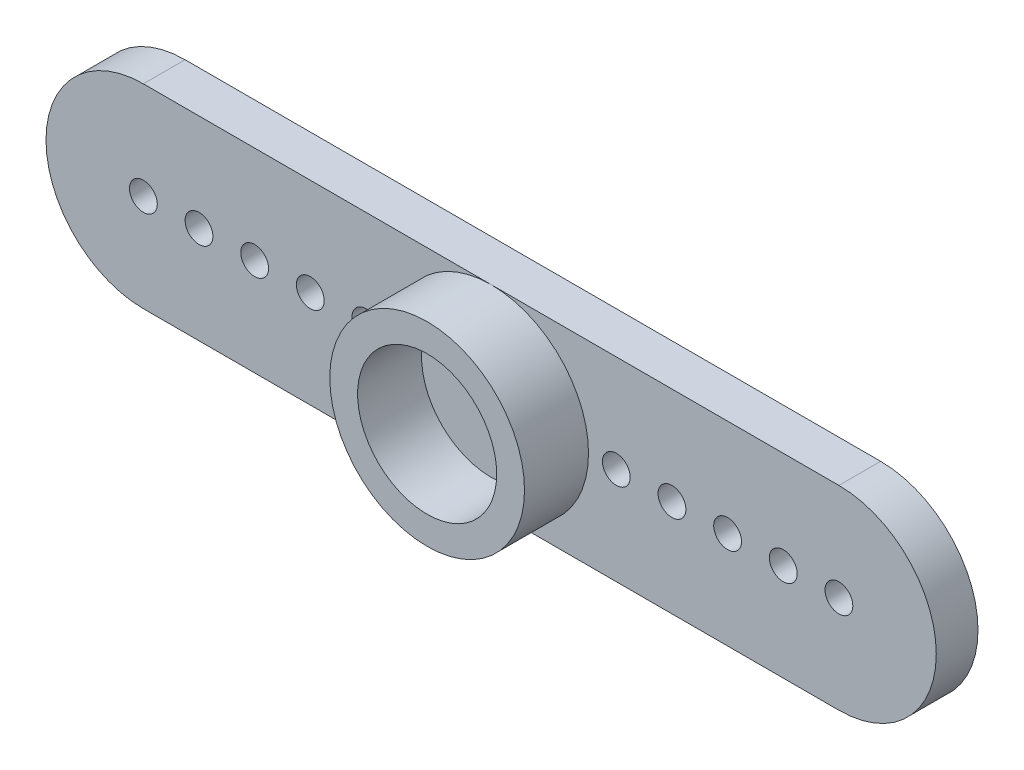
from build123d import *

# Parameters (mm, degrees)
SALIENTE_EXTRUIR1_DEPTH = 1.5
CROQUIS2_R              = 3.5
CROQUIS2_R_2            = 2.5
SALIENTE_EXTRUIR2_DEPTH = 2.3
CROQUIS4_R              = 0.5
CORTAR_EXTRUIR1_DEPTH   = 29.964460982
CORTAR_EXTRUIR2_REACH   = 30.964
CROQUIS5_R              = 0.5


with BuildPart() as part:
    # Croquis1 → Saliente-Extruir1 (new body)
    with BuildSketch(Plane.XY):
        with BuildLine():
            Line((0, 3.5), (25, 3.5))
            ThreePointArc((25, 3.5), (28.5, 0), (25, -3.5))
            Line((25, -3.5), (0, -3.5))
            ThreePointArc((0, -3.5), (-3.5, 0), (0, 3.5))
        make_face()
    extrude(amount=SALIENTE_EXTRUIR1_DEPTH)

    # Croquis2 → Saliente-Extruir2 (add)
    with BuildSketch(Plane.XY.offset(1.5)):
        with Locations(Location((12.5, 0, 0), (0, 0, 270))):
            Circle(CROQUIS2_R)
        with Locations((12.5, 0)):
            Circle(CROQUIS2_R_2, mode=Mode.SUBTRACT)
    extrude(amount=SALIENTE_EXTRUIR2_DEPTH)

    # Croquis4 → Cortar-Extruir1 (cut, through all)
    with BuildSketch(Plane(origin=(0, 0, 0), x_dir=(-1, 0, 0), z_dir=(0, 0, -1))):
        Circle(CROQUIS4_R)
        with Locations(Location((-25, 0, 0), (0, 0, 180))):
            Circle(CROQUIS4_R)
    extrude(amount=-CORTAR_EXTRUIR1_DEPTH, mode=Mode.SUBTRACT)

    # Croquis5 → Cortar-Extruir2 (cut, up to next)
    with BuildSketch(Plane(origin=(0, 0, 0), x_dir=(-1, 0, 0), z_dir=(0, 0, -1)), mode=Mode.PRIVATE) as cortar_extruir2_sk1:
        with Locations((-8, 0)):
            Circle(CROQUIS5_R)
    cortar_extruir2_tool1 = extrude(cortar_extruir2_sk1.sketch, amount=-CORTAR_EXTRUIR2_REACH, mode=Mode.PRIVATE) & part.part
    # Croquis5 → Cortar-Extruir2 (cut, up to next)
    with BuildSketch(Plane(origin=(0, 0, 0), x_dir=(-1, 0, 0), z_dir=(0, 0, -1)), mode=Mode.PRIVATE) as cortar_extruir2_sk2:
        with Locations((-6, 0)):
            Circle(CROQUIS5_R)
    cortar_extruir2_tool2 = extrude(cortar_extruir2_sk2.sketch, amount=-CORTAR_EXTRUIR2_REACH, mode=Mode.PRIVATE) & part.part
    # Croquis5 → Cortar-Extruir2 (cut, up to next)
    with BuildSketch(Plane(origin=(0, 0, 0), x_dir=(-1, 0, 0), z_dir=(0, 0, -1)), mode=Mode.PRIVATE) as cortar_extruir2_sk3:
        with Locations((-4, 0)):
            Circle(CROQUIS5_R)
    cortar_extruir2_tool3 = extrude(cortar_extruir2_sk3.sketch, amount=-CORTAR_EXTRUIR2_REACH, mode=Mode.PRIVATE) & part.part
    # Croquis5 → Cortar-Extruir2 (cut, up to next)
    with BuildSketch(Plane(origin=(0, 0, 0), x_dir=(-1, 0, 0), z_dir=(0, 0, -1)), mode=Mode.PRIVATE) as cortar_extruir2_sk4:
        with Locations((-2, 0)):
            Circle(CROQUIS5_R)
    cortar_extruir2_tool4 = extrude(cortar_extruir2_sk4.sketch, amount=-CORTAR_EXTRUIR2_REACH, mode=Mode.PRIVATE) & part.part
    # Croquis5 → Cortar-Extruir2 (cut, up to next)
    with BuildSketch(Plane(origin=(0, 0, 0), x_dir=(-1, 0, 0), z_dir=(0, 0, -1)), mode=Mode.PRIVATE) as cortar_extruir2_sk5:
        with Locations(Location((-23, 0, 0), (0, 0, 180))):
            Circle(CROQUIS5_R)
    cortar_extruir2_tool5 = extrude(cortar_extruir2_sk5.sketch, amount=-CORTAR_EXTRUIR2_REACH, mode=Mode.PRIVATE) & part.part
    # Croquis5 → Cortar-Extruir2 (cut, up to next)
    with BuildSketch(Plane(origin=(0, 0, 0), x_dir=(-1, 0, 0), z_dir=(0, 0, -1)), mode=Mode.PRIVATE) as cortar_extruir2_sk6:
        with Locations(Location((-21, 0, 0), (0, 0, 180))):
            Circle(CROQUIS5_R)
    cortar_extruir2_tool6 = extrude(cortar_extruir2_sk6.sketch, amount=-CORTAR_EXTRUIR2_REACH, mode=Mode.PRIVATE) & part.part
    # Croquis5 → Cortar-Extruir2 (cut, up to next)
    with BuildSketch(Plane(origin=(0, 0, 0), x_dir=(-1, 0, 0), z_dir=(0, 0, -1)), mode=Mode.PRIVATE) as cortar_extruir2_sk7:
        with Locations(Location((-19, 0, 0), (0, 0, 180))):
            Circle(CROQUIS5_R)
    cortar_extruir2_tool7 = extrude(cortar_extruir2_sk7.sketch, amount=-CORTAR_EXTRUIR2_REACH, mode=Mode.PRIVATE) & part.part
    # Croquis5 → Cortar-Extruir2 (cut, up to next)
    with BuildSketch(Plane(origin=(0, 0, 0), x_dir=(-1, 0, 0), z_dir=(0, 0, -1)), mode=Mode.PRIVATE) as cortar_extruir2_sk8:
        with Locations(Location((-17, 0, 0), (0, 0, 180))):
            Circle(CROQUIS5_R)
    cortar_extruir2_tool8 = extrude(cortar_extruir2_sk8.sketch, amount=-CORTAR_EXTRUIR2_REACH, mode=Mode.PRIVATE) & part.part
    add(cortar_extruir2_tool1.solids().sort_by_distance((8, 0, 0))[0], mode=Mode.SUBTRACT)
    add(cortar_extruir2_tool2.solids().sort_by_distance((6, 0, 0))[0], mode=Mode.SUBTRACT)
    add(cortar_extruir2_tool3.solids().sort_by_distance((4, 0, 0))[0], mode=Mode.SUBTRACT)
    add(cortar_extruir2_tool4.solids().sort_by_distance((2, 0, 0))[0], mode=Mode.SUBTRACT)
    add(cortar_extruir2_tool5.solids().sort_by_distance((23, 0, 0))[0], mode=Mode.SUBTRACT)
    add(cortar_extruir2_tool6.solids().sort_by_distance((21, 0, 0))[0], mode=Mode.SUBTRACT)
    add(cortar_extruir2_tool7.solids().sort_by_distance((19, 0, 0))[0], mode=Mode.SUBTRACT)
    add(cortar_extruir2_tool8.solids().sort_by_distance((17, 0, 0))[0], mode=Mode.SUBTRACT)


solid = part.part
